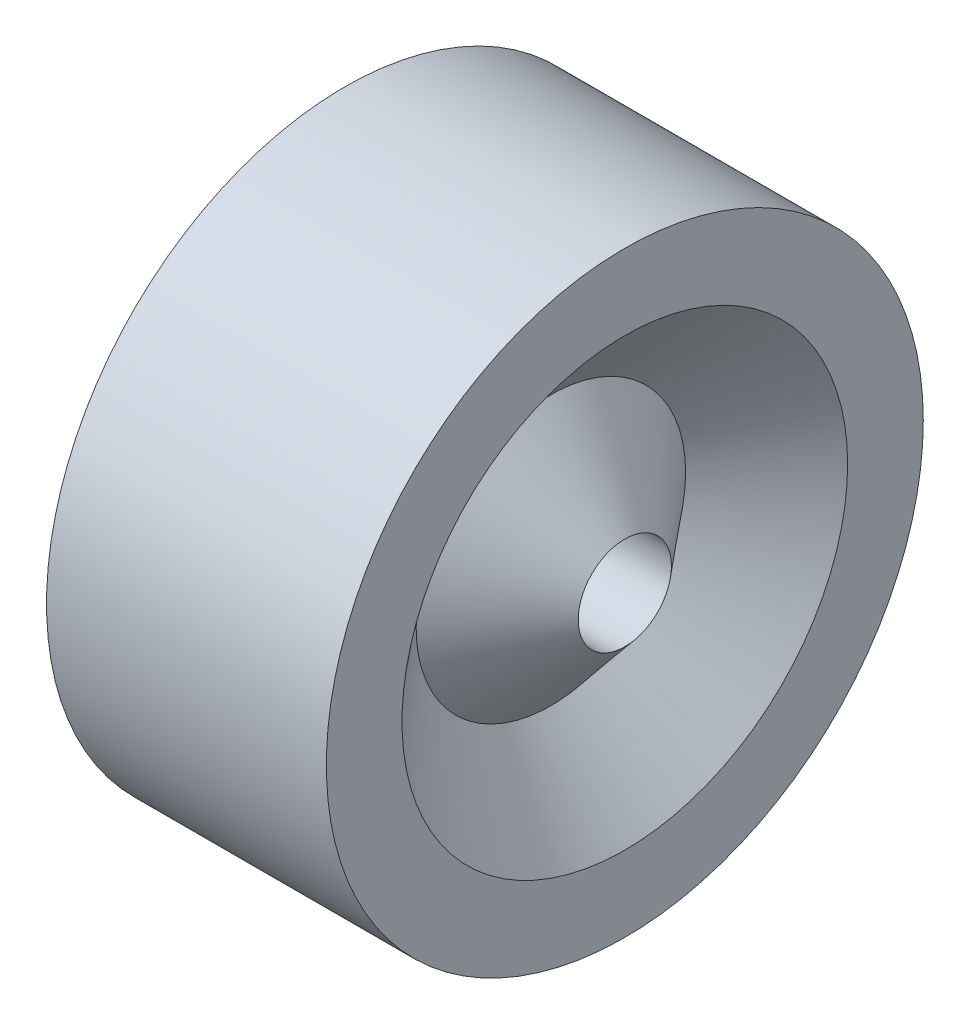
from build123d import *

# Parameters (mm, degrees)
SKETCH_1_R          = 32
SKETCH_1_R_2        = 5
EXTRUDE_1_DEPTH     = 30
SKETCH_2_R          = 23.890654285
SKETCH_2_R_2        = 5
CUT_EXTRUDE_1_DEPTH = 10
CUT_EXTRUDE_1_TAPER = 50


with BuildPart() as part:
    # Эскиз1 → Бобышка-Вытянуть1 (new body)
    with BuildSketch(Plane(origin=(0, 0, 0), x_dir=(0, 0, -1), z_dir=(1, 0, 0))):
        Circle(SKETCH_1_R)
        Circle(SKETCH_1_R_2, mode=Mode.SUBTRACT)
    extrude(amount=EXTRUDE_1_DEPTH)

    # Эскиз2 → Вырез-Вытянуть1 (cut)
    with BuildSketch(Plane(origin=(30, 0, 0), x_dir=(0, 0, -1), z_dir=(1, 0, 0))):
        Circle(SKETCH_2_R)
        Circle(SKETCH_2_R_2, mode=Mode.SUBTRACT)
    extrude(amount=-CUT_EXTRUDE_1_DEPTH, taper=CUT_EXTRUDE_1_TAPER, mode=Mode.SUBTRACT)


solid = part.part
